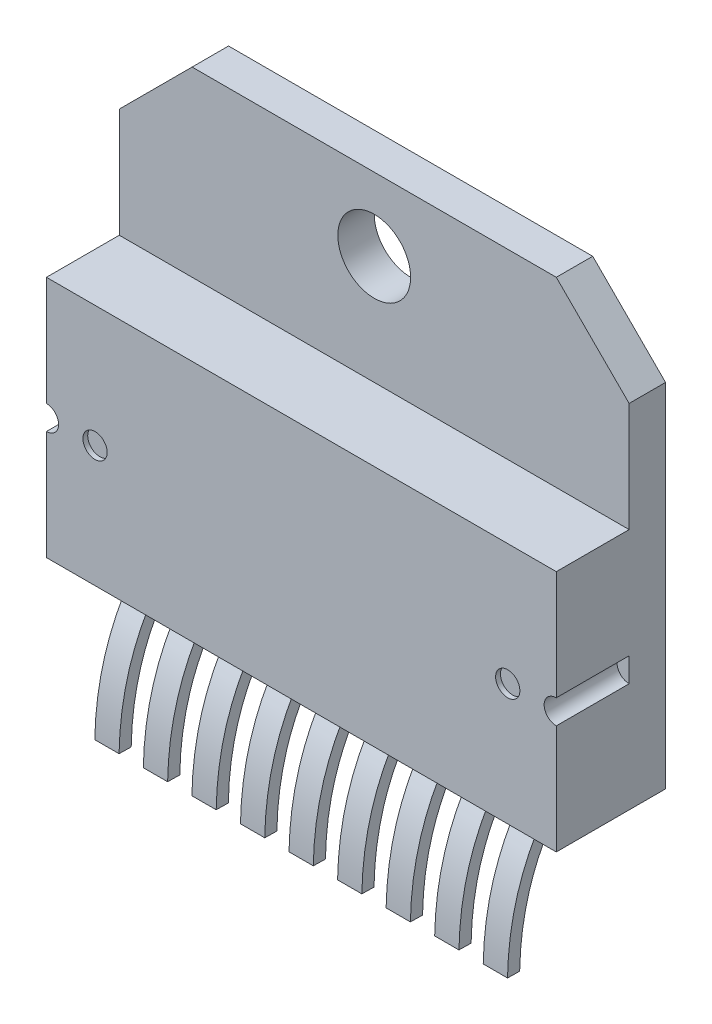
from build123d import *

# Parameters (mm, degrees)
Y_KSEKLIK_EKSTR_ZYON1_DEPTH      = 1.5
IZIM2_W                          = 21
IZIM2_H                          = 10
Y_KSEKLIK_EKSTR_ZYON2_DEPTH      = 3
KES_EKSTR_ZYON1_DEPTH            = 3
IZIM4_R                          = 0.5
KES_EKSTR_ZYON2_DEPTH            = 0.2
Y_KSEKLIK_EKSTR_ZYON3_DEPTH      = 10
Y_KSEKLIK_EKSTR_ZYON3_DEPTH_BACK = 10
KES_EKSTR_ZYON3_DEPTH            = 10
IZIM9_R                          = 1.5
KES_EKSTR_ZYON4_DEPTH            = 10


with BuildPart() as part:
    # Çizim1 → Yükseklik-Ekstrüzyon1 (new body)
    with BuildSketch(Plane.XY):
        Polygon((-10.5, 5.75), (-7.5, 8.75), (7.5, 8.75), (10.5, 5.75), (10.5, -8.75), (-10.5, -8.75), align=None)
    extrude(amount=Y_KSEKLIK_EKSTR_ZYON1_DEPTH)

    # Çizim2 → Yükseklik-Ekstrüzyon2 (add)
    with BuildSketch(Plane.XY.offset(1.5)):
        with Locations((0, -3.75)):
            Rectangle(IZIM2_W, IZIM2_H)
    extrude(amount=Y_KSEKLIK_EKSTR_ZYON2_DEPTH)

    # Çizim3 → Kes-Ekstrüzyon1 (cut)
    with BuildSketch(Plane.XY.offset(4.5)):
        with BuildLine():
            Line((-10.5, -3.25), (-10.5, -4.25))
            ThreePointArc((-10.5, -4.25), (-10, -3.75), (-10.5, -3.25))
        make_face()
        with BuildLine():
            Line((10.5, -3.25), (10.5, -4.25))
            ThreePointArc((10.5, -4.25), (10, -3.75), (10.5, -3.25))
        make_face()
    extrude(amount=-KES_EKSTR_ZYON1_DEPTH, mode=Mode.SUBTRACT)

    # Çizim4 → Kes-Ekstrüzyon2 (cut)
    with BuildSketch(Plane.XY.offset(4.5)):
        with Locations((-8.5, -3.75)):
            Circle(IZIM4_R)
        with Locations(Location((8.5, -3.75, 0), (0, 0, 180))):
            Circle(IZIM4_R)
    extrude(amount=-KES_EKSTR_ZYON2_DEPTH, mode=Mode.SUBTRACT)

    # Çizim5 → Yükseklik-Ekstrüzyon3 (add, two sides: drawn at the far end of the back side and taken through both)
    with BuildSketch(Plane(origin=(0, 0, 0), x_dir=(0, 0, -1), z_dir=(1, 0, 0)).offset(-Y_KSEKLIK_EKSTR_ZYON3_DEPTH_BACK)):
        with BuildLine():
            Line((-2.121056986, -8.114958286), (-1.763284227, -8.464241342))
            add(Edge.make_bspline(
                [(-4.000086505, -14.259300429), (-3.994612568, -13.965067214), (-3.960806645, -13.366672985), (-3.805455262, -12.259533496), (-3.446184905, -10.981070899), (-2.76204135, -9.632169884), (-2.11843608, -8.828025544), (-1.763284227, -8.464241342)],
                knots=[0, 0, 0, 0, 0.125, 0.25, 0.5, 0.75, 1, 1, 1, 1], degree=3))
            Line((-4.000086505, -14.259300429), (-4.5, -14.25))
            add(Edge.make_bspline(
                [(-4.5, -14.25), (-4.429860392, -10.479879656), (-2.121056986, -8.114958286)],
                knots=[0, 0, 0, 1, 1, 1], degree=2))
        make_face()
    extrude(amount=Y_KSEKLIK_EKSTR_ZYON3_DEPTH + Y_KSEKLIK_EKSTR_ZYON3_DEPTH_BACK)

    # Çizim8 → Kes-Ekstrüzyon3 (cut)
    with BuildSketch(Plane.XY.offset(7)):
        Polygon((-8.509588272, -14.25), (-8.509588272, -8.75), (-9.509588272, -8.75), (-10, -8.75), (-10, -14.25), (-10, -14.939663009), (-8.509588272, -14.939663009), align=None)
        Polygon((-6.509588272, -8.75), (-7.509588272, -8.75), (-7.509588272, -14.25), (-7.509588272, -14.939663009), (-6.509588272, -14.939663009), (-6.509588272, -14.25), align=None)
        Polygon((-4.509588272, -8.75), (-5.509588272, -8.75), (-5.509588272, -14.25), (-5.509588272, -14.939663009), (-4.509588272, -14.939663009), (-4.509588272, -14.25), align=None)
        Polygon((-2.509588272, -8.75), (-3.509588272, -8.75), (-3.509588272, -14.25), (-3.509588272, -14.939663009), (-2.509588272, -14.939663009), (-2.509588272, -14.25), align=None)
        Polygon((-1.509588272, -14.939663009), (-0.509588272, -14.939663009), (-0.509588272, -14.25), (-0.509588272, -8.75), (-1.509588272, -8.75), (-1.509588272, -14.25), align=None)
        Polygon((0.490411728, -14.939663009), (1.490411728, -14.939663009), (1.490411728, -14.25), (1.490411728, -8.75), (0.490411728, -8.75), (0.490411728, -14.25), align=None)
        Polygon((3.490411728, -8.75), (2.490411728, -8.75), (2.490411728, -14.25), (2.490411728, -14.939663009), (3.490411728, -14.939663009), (3.490411728, -14.25), align=None)
        Polygon((5.490411728, -8.75), (4.490411728, -8.75), (4.490411728, -14.25), (4.490411728, -14.939663009), (5.490411728, -14.939663009), (5.490411728, -14.25), align=None)
        Polygon((7.490411728, -8.75), (6.490411728, -8.75), (6.490411728, -14.25), (6.490411728, -14.939663009), (7.490411728, -14.939663009), (7.490411728, -14.25), align=None)
        Polygon((9.490411728, -8.75), (8.490411728, -8.75), (8.490411728, -14.25), (8.490411728, -14.939663009), (10, -14.939663009), (10, -14.25), (10, -8.75), align=None)
    extrude(amount=-KES_EKSTR_ZYON3_DEPTH, mode=Mode.SUBTRACT)

    # Çizim9 → Kes-Ekstrüzyon4 (cut)
    with BuildSketch(Plane.XY.offset(1.5)):
        with Locations((0, 5.75)):
            Circle(IZIM9_R)
    extrude(amount=-KES_EKSTR_ZYON4_DEPTH, mode=Mode.SUBTRACT)


solid = part.part
